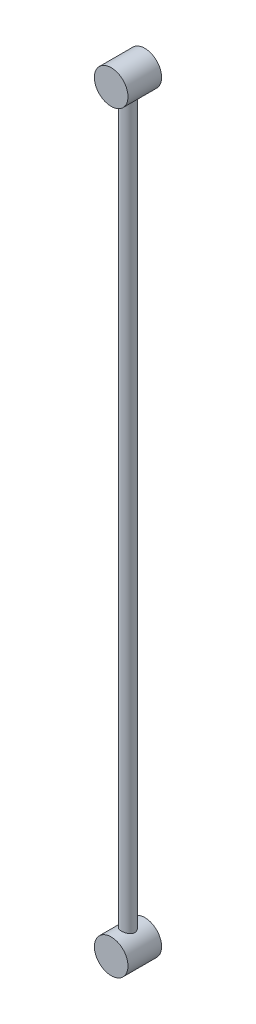
from build123d import *

# Parameters (mm, degrees)
SKETCH1_R                = 5
BOSS_EXTRUDE1_DEPTH      = 80
BOSS_EXTRUDE2_DEPTH      = 10
BOSS_EXTRUDE2_DEPTH_BACK = 10
SKETCH2_R                = 10
SKETCH3_R                = 3.98820793
BOSS_EXTRUDE3_DEPTH      = 450


with BuildPart() as part:
    # Sketch1 → Boss-Extrude1 (new body)
    with BuildSketch(Plane(origin=(0, 0, 0), x_dir=(0, 0, -1), z_dir=(1, 0, 0))):
        Circle(SKETCH1_R)
    extrude(amount=BOSS_EXTRUDE1_DEPTH)


with BuildPart() as body_2:
    # Sketch2 → Boss-Extrude2 (new, two sides: drawn at the far end of the back side and taken through both)
    with BuildSketch(Plane.XY.offset(-BOSS_EXTRUDE2_DEPTH_BACK)):
        with Locations((-7.666034923, 0)):
            Circle(SKETCH2_R)
    extrude(amount=BOSS_EXTRUDE2_DEPTH + BOSS_EXTRUDE2_DEPTH_BACK)


with BuildPart() as body_3:
    # Mirror1: mirrored copy
    add(part.part.mirror(Plane.ZX.offset(-224)))


with BuildPart() as body_4:
    # Mirror1 2: mirrored copy
    add(body_2.part.mirror(Plane.ZX.offset(-224)))


with BuildPart() as body_2_1:
    add(body_2.part)

    add(body_4.part)  # Boss-Extrude3 merges body 4
    # Sketch3 → Boss-Extrude3 (add)
    with BuildSketch(Plane(origin=(0, 0, 0), x_dir=(1, 0, 0), z_dir=(0, 1, 0))):
        with Locations((-7.666034923, 0)):
            Circle(SKETCH3_R)
    extrude(amount=-BOSS_EXTRUDE3_DEPTH)


solid = body_2_1.part
